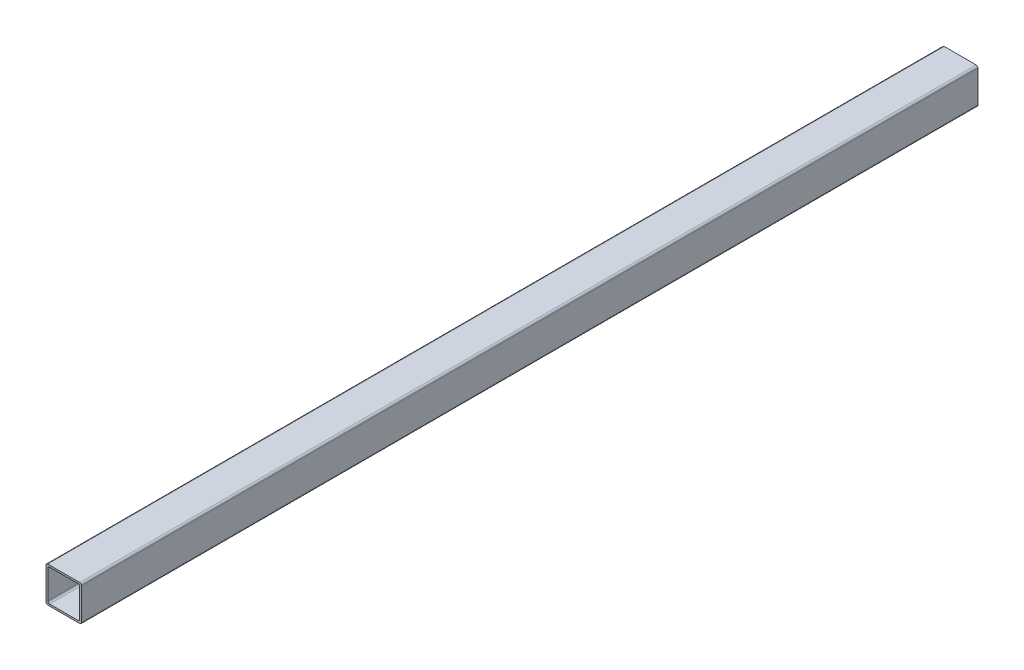
from build123d import *

# Parameters (mm, degrees)
EXTRUDE_1_DEPTH = 1010


with BuildPart() as part:
    # Эскиз1 → Бобышка-Вытянуть1 (new body)
    with BuildSketch(Plane.XY):
        with BuildLine():
            Line((18, -20), (-18, -20))
            ThreePointArc((-18, -20), (-19.414213562, -19.414213562), (-20, -18))
            Line((-20, -18), (-20, 18))
            ThreePointArc((-20, 18), (-19.414213562, 19.414213562), (-18, 20))
            Line((-18, 20), (18, 20))
            ThreePointArc((18, 20), (19.414213562, 19.414213562), (20, 18))
            Line((20, 18), (20, -18))
            ThreePointArc((20, -18), (19.414213562, -19.414213562), (18, -20))
        make_face()
        with BuildLine():
            Line((-16, 18), (16, 18))
            ThreePointArc((16, 18), (17.414213562, 17.414213562), (18, 16))
            Line((18, 16), (18, -16))
            ThreePointArc((18, -16), (17.414213562, -17.414213562), (16, -18))
            Line((16, -18), (-16, -18))
            ThreePointArc((-16, -18), (-17.414213562, -17.414213562), (-18, -16))
            Line((-18, -16), (-18, 16))
            ThreePointArc((-18, 16), (-17.414213562, 17.414213562), (-16, 18))
        make_face(mode=Mode.SUBTRACT)
    extrude(amount=EXTRUDE_1_DEPTH)


solid = part.part
